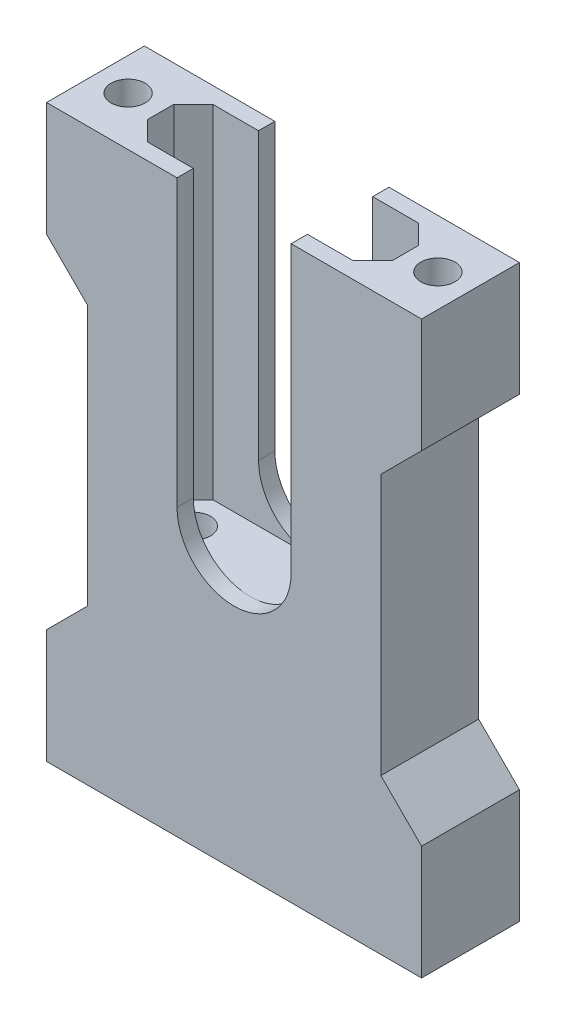
from build123d import *

# Parameters (mm, degrees)
DODANIE_WYCI_GNI_CIE1_DEPTH = 12
SZKIC2_R                    = 2.1
WYTNIJ_WYCI_GNI_CIE1_DEPTH  = 10
WYTNIJ_WYCI_GNI_CIE2_DEPTH  = 42
WYTNIJ_WYCI_GNI_CIE3_REACH  = 51.366
SZKIC4_R                    = 2.1
WYTNIJ_WYCI_GNI_CIE4_DEPTH  = 6


with BuildPart() as part:
    # Szkic1 → Dodanie-wyciągnięcie1 (new body)
    with BuildSketch(Plane.XY):
        with BuildLine():
            Line((-23, 0), (23, 0))
            Line((23, 0), (23, 14))
            Line((23, 14), (18, 19))
            Line((18, 19), (18, 51))
            Line((18, 51), (23, 56))
            Line((23, 56), (23, 70))
            Line((23, 70), (7, 70))
            Line((7, 70), (7, 35))
            ThreePointArc((7, 35), (0, 28), (-7, 35))
            Line((-7, 35), (-7, 70))
            Line((-7, 70), (-23, 70))
            Line((-23, 70), (-23, 56))
            Line((-23, 56), (-18, 51))
            Line((-18, 51), (-18, 19))
            Line((-18, 19), (-23, 14))
            Line((-23, 14), (-23, 0))
        make_face()
    extrude(amount=DODANIE_WYCI_GNI_CIE1_DEPTH)

    # Szkic2 → Wytnij-wyciągnięcie1 (cut)
    with BuildSketch(Plane(origin=(0, 70, 0), x_dir=(1, 0, 0), z_dir=(0, 1, 0))):
        with Locations(Location((-19, -6, 0), (0, 0, 270))):
            Circle(SZKIC2_R)
        with Locations(Location((19, -6, 0), (0, 0, 270))):
            Circle(SZKIC2_R)
    wytnij_wyci_gni_cie1 = extrude(amount=-WYTNIJ_WYCI_GNI_CIE1_DEPTH, mode=Mode.SUBTRACT)

    # Lustro1: Wytnij-wyciągnięcie1 across plane
    add(wytnij_wyci_gni_cie1.mirror(Plane(origin=(0, 35, 0), x_dir=(0, 0, 1), z_dir=(0, -1, 0))), mode=Mode.SUBTRACT)

    # Szkic3 → Wytnij-wyciągnięcie2 (cut)
    with BuildSketch(Plane(origin=(0, 70, 0), x_dir=(-1, 0, 0), z_dir=(0, -1, 0))):
        Polygon((12.6, -2), (-12.6, -2), (-15, -4.4), (-15, -7.6), (-12.6, -10), (12.6, -10), (15, -7.6), (15, -4.4), align=None)
    extrude(amount=WYTNIJ_WYCI_GNI_CIE2_DEPTH, mode=Mode.SUBTRACT)

    # Szkic4 → Wytnij-wyciągnięcie3 (cut, up to next)
    with BuildSketch(Plane(origin=(0, 28, 0), x_dir=(1, 0, 0), z_dir=(0, 1, 0)), mode=Mode.PRIVATE) as wytnij_wyci_gni_cie3_sk1:
        with Locations(Location((11, -6, 0), (0, 0, 270))):
            Circle(SZKIC4_R)
    wytnij_wyci_gni_cie3_tool1 = extrude(wytnij_wyci_gni_cie3_sk1.sketch, amount=-WYTNIJ_WYCI_GNI_CIE3_REACH, mode=Mode.PRIVATE) & part.part
    # Szkic4 → Wytnij-wyciągnięcie3 (cut, up to next)
    with BuildSketch(Plane(origin=(0, 28, 0), x_dir=(1, 0, 0), z_dir=(0, 1, 0)), mode=Mode.PRIVATE) as wytnij_wyci_gni_cie3_sk2:
        with Locations(Location((-11, -6, 0), (0, 0, 270))):
            Circle(SZKIC4_R)
    wytnij_wyci_gni_cie3_tool2 = extrude(wytnij_wyci_gni_cie3_sk2.sketch, amount=-WYTNIJ_WYCI_GNI_CIE3_REACH, mode=Mode.PRIVATE) & part.part
    add(wytnij_wyci_gni_cie3_tool1.solids().sort_by_distance((11, 28, 6))[0], mode=Mode.SUBTRACT)
    add(wytnij_wyci_gni_cie3_tool2.solids().sort_by_distance((-11, 28, 6))[0], mode=Mode.SUBTRACT)

    # Szkic5 → Wytnij-wyciągnięcie4 (cut)
    with BuildSketch(Plane.XZ):
        Polygon((11, 1.727608008), (14.7, 3.863804004), (14.7, 8.136195996), (11, 10.272391992), (7.3, 8.136195996), (7.3, 3.863804004), align=None)
        Polygon((-7.3, 3.863804004), (-11, 1.727608008), (-14.7, 3.863804004), (-14.7, 8.136195996), (-11, 10.272391992), (-7.3, 8.136195996), align=None)
    extrude(amount=-WYTNIJ_WYCI_GNI_CIE4_DEPTH, mode=Mode.SUBTRACT)


solid = part.part
